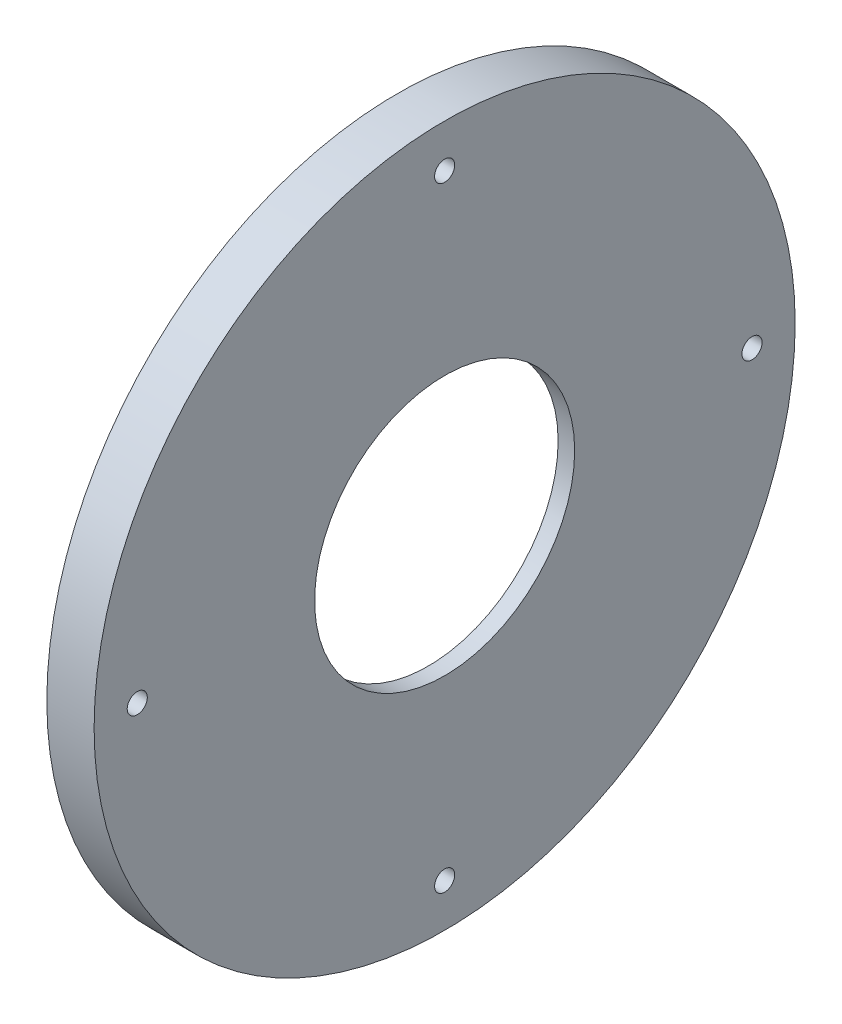
from build123d import *

# Parameters (mm, degrees)
ESQUISSE1_W             = 20
ESQUISSE1_H             = 148.25
ESQUISSE2_R             = 55
ENL_V_MAT_EXTRU_1_DEPTH = 211.608938557
ESQUISSE3_R             = 87.63760146
ENL_V_MAT_EXTRU_2_DEPTH = 13
TROU_TARAUD_M101_D      = 8.5


with BuildPart() as part:
    # Esquisse1 → Révolution1 (revolve)
    with BuildSketch(Plane.XY, mode=Mode.PRIVATE) as r_volution1_sk:
        with Locations((397.851746626, 74.125)):
            Rectangle(ESQUISSE1_W, ESQUISSE1_H)
    revolve(r_volution1_sk.sketch.rotate(Axis((22.672384616, 0, 0), (1, 0, 0)), 90), axis=Axis((22.672384616, 0, 0), (1, 0, 0)))

    # Esquisse2 → Enlèv. mat.-Extru.1 (cut, through all)
    with BuildSketch(Plane(origin=(407.851746626, 0, 0), x_dir=(0, 0, -1), z_dir=(1, 0, 0))):
        Circle(ESQUISSE2_R)
    extrude(amount=-ENL_V_MAT_EXTRU_1_DEPTH, mode=Mode.SUBTRACT)

    # Esquisse3 → Enlèv. mat.-Extru.2 (cut)
    with BuildSketch(Plane.ZY.offset(-387.851746626)):
        Circle(ESQUISSE3_R)
    extrude(amount=-ENL_V_MAT_EXTRU_2_DEPTH, mode=Mode.SUBTRACT)

    # Trou taraudé M101 (through all)
    with Locations(Plane(origin=(387.851746626, 130, 0), x_dir=(0, 0, -1), z_dir=(-1, 0, 0))):
        with Locations((0, 0), (130, 130), (0, 260), (-130, 130)):
            Hole(TROU_TARAUD_M101_D / 2)


solid = part.part
